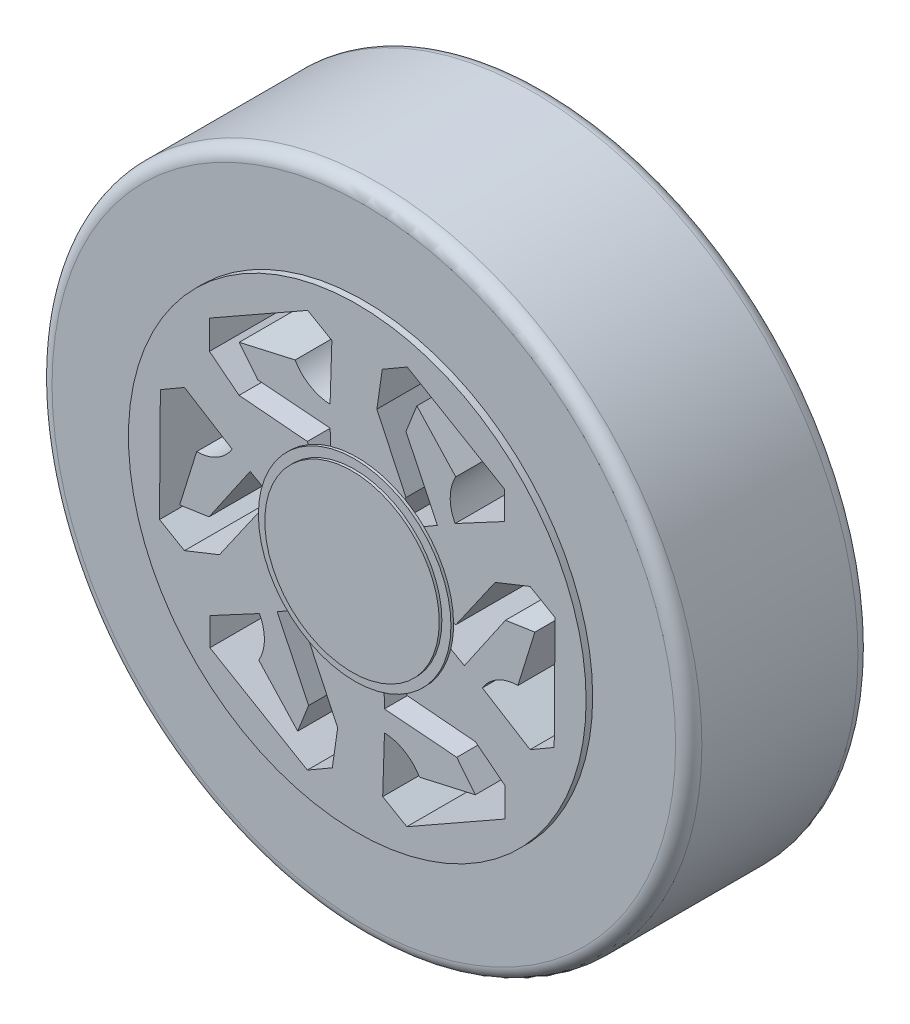
from build123d import *

# Parameters (mm, degrees)
SKETCH2_R           = 247.55
BOSS_EXTRUDE1_DEPTH = 138.9
FILLET1_R           = 10
FILLET2_R           = 10
SKETCH3_R           = 174.35
BOSS_EXTRUDE2_DEPTH = 5
CUT_EXTRUDE1_DEPTH  = 178
SKETCH9_R           = 73.351235991
BOSS_EXTRUDE3_DEPTH = 2
SKETCH10_R          = 66.449367693
BOSS_EXTRUDE4_DEPTH = 2


with BuildPart() as part:
    # Sketch2 → Boss-Extrude1 (new body)
    with BuildSketch(Plane.XY):
        Circle(SKETCH2_R)
    extrude(amount=BOSS_EXTRUDE1_DEPTH)

    # Fillet1
    fillet1_edges = [part.edges().sort_by_distance(p)[0] for p in [
        (-247.55, 0, 138.9),
    ]]
    fillet(fillet1_edges, radius=FILLET1_R)

    # Fillet2
    fillet2_edges = [part.edges().sort_by_distance(p)[0] for p in [
        (-247.55, 0, 0),
    ]]
    fillet(fillet2_edges, radius=FILLET2_R)

    # Sketch3 → Boss-Extrude2 (add)
    with BuildSketch(Plane.XY.offset(138.9)):
        Circle(SKETCH3_R)
    extrude(amount=BOSS_EXTRUDE2_DEPTH)

    # Sketch5 → Cut-Extrude1 (cut)
    with BuildSketch(Plane.XY.offset(143.9)):
        with BuildLine():
            Line((105.003706731, 43.369407929), (131.633696581, 54.021395774))
            Line((131.633696581, 54.021395774), (150.665269372, 43.031925067))
            Line((150.665269372, 43.031925067), (150.344554361, -0.360940867))
            Line((150.344554361, -0.360940867), (150.02910614, -43.041207894))
            Line((150.02910614, -43.041207894), (131.640430833, -53.657914533))
            Line((131.640430833, -53.657914533), (95.29019948, -31.084252667))
            ThreePointArc((95.29019948, -31.084252667), (106.873400183, -20.029907867), (122.363240346, -15.976029572))
            Line((122.363240346, -15.976029572), (135.299603851, 25.697677813))
            Line((135.299603851, 25.697677813), (112.925565246, 22.34468352))
            Line((112.925565246, 22.34468352), (81.592210025, -23.310129617))
            Line((81.592210025, -23.310129617), (40.25767623, 0.148769441))
            Line((40.25767623, 0.148769441), (75.177682959, 0.55093352))
            Line((75.177682959, 0.55093352), (105.003706731, 43.369407929))
        make_face()
        with BuildLine():
            Line((90.060862379, -69.251173556), (112.600749379, -86.987427346))
            Line((112.600749379, -86.987427346), (112.599374968, -108.963988211))
            Line((112.599374968, -108.963988211), (74.859693221, -130.38267383))
            Line((74.859693221, -130.38267383), (37.739773625, -151.449621172))
            Line((37.739773625, -151.449621172), (19.351098317, -140.832914533))
            Line((19.351098317, -140.832914533), (20.725347273, -98.065859815))
            ThreePointArc((20.725347273, -98.065859815), (36.090291044, -102.570033481), (47.345972712, -113.957689415))
            Line((47.345972712, -113.957689415), (89.90464373, -104.32405515))
            Line((89.90464373, -104.32405515), (75.813846191, -86.62406648))
            Line((75.813846191, -86.62406648), (20.608940598, -82.315991441))
            Line((20.608940598, -82.315991441), (20.25767623, -34.789785592))
            Line((20.25767623, -34.789785592), (38.065963903, -64.83031648))
            Line((38.065963903, -64.83031648), (90.060862379, -69.251173556))
        make_face()
        with BuildLine():
            Line((19.032947202, 141.008823121), (38.065894405, 151.995913278))
            Line((38.065894405, 151.995913278), (75.48486114, 130.021732964))
            Line((75.48486114, 130.021732964), (112.289332516, 108.408413278))
            Line((112.289332516, 108.408413278), (112.289332516, 87.175))
            Line((112.289332516, 87.175), (74.564852207, 66.981607148))
            ThreePointArc((74.564852207, 66.981607148), (70.78310914, 82.540125614), (75.017267633, 97.981659843))
            Line((75.017267633, 97.981659843), (45.394960121, 130.021732964))
            Line((45.394960121, 130.021732964), (37.111719056, 108.96875))
            Line((37.111719056, 108.96875), (60.983269426, 59.005861824))
            Line((60.983269426, 59.005861824), (20, 34.938555033))
            Line((20, 34.938555033), (37.111719056, 65.38125))
            Line((37.111719056, 65.38125), (14.942844352, 112.620581485))
            Line((14.942844352, 112.620581485), (19.032947202, 141.008823121))
        make_face()
        with BuildLine():
            Line((-14.942844352, -112.620581485), (-19.032947202, -141.008823121))
            Line((-19.032947202, -141.008823121), (-38.065894405, -151.995913278))
            Line((-38.065894405, -151.995913278), (-75.48486114, -130.021732964))
            Line((-75.48486114, -130.021732964), (-112.289332516, -108.408413278))
            Line((-112.289332516, -108.408413278), (-112.289332516, -87.175))
            Line((-112.289332516, -87.175), (-74.564852207, -66.981607148))
            ThreePointArc((-74.564852207, -66.981607148), (-70.78310914, -82.540125614), (-75.017267633, -97.981659843))
            Line((-75.017267633, -97.981659843), (-45.394960121, -130.021732964))
            Line((-45.394960121, -130.021732964), (-37.111719056, -108.96875))
            Line((-37.111719056, -108.96875), (-60.983269426, -59.005861824))
            Line((-60.983269426, -59.005861824), (-20, -34.938555033))
            Line((-20, -34.938555033), (-37.111719056, -65.38125))
            Line((-37.111719056, -65.38125), (-14.942844352, -112.620581485))
        make_face()
        with BuildLine():
            Line((-105.003706731, -43.369407929), (-131.633696581, -54.021395774))
            Line((-131.633696581, -54.021395774), (-150.665269372, -43.031925067))
            Line((-150.665269372, -43.031925067), (-150.344554361, 0.360940867))
            Line((-150.344554361, 0.360940867), (-150.02910614, 43.041207894))
            Line((-150.02910614, 43.041207894), (-131.640430833, 53.657914533))
            Line((-131.640430833, 53.657914533), (-95.29019948, 31.084252667))
            ThreePointArc((-95.29019948, 31.084252667), (-106.873400183, 20.029907867), (-122.363240346, 15.976029572))
            Line((-122.363240346, 15.976029572), (-135.299603851, -25.697677813))
            Line((-135.299603851, -25.697677813), (-112.925565246, -22.34468352))
            Line((-112.925565246, -22.34468352), (-81.592210025, 23.310129617))
            Line((-81.592210025, 23.310129617), (-40.25767623, -0.148769441))
            Line((-40.25767623, -0.148769441), (-75.177682959, -0.55093352))
            Line((-75.177682959, -0.55093352), (-105.003706731, -43.369407929))
        make_face()
        with BuildLine():
            Line((-90.060862379, 69.251173556), (-112.600749379, 86.987427346))
            Line((-112.600749379, 86.987427346), (-112.599374968, 108.963988211))
            Line((-112.599374968, 108.963988211), (-74.859693221, 130.38267383))
            Line((-74.859693221, 130.38267383), (-37.739773625, 151.449621172))
            Line((-37.739773625, 151.449621172), (-19.351098317, 140.832914533))
            Line((-19.351098317, 140.832914533), (-20.725347273, 98.065859815))
            ThreePointArc((-20.725347273, 98.065859815), (-36.090291044, 102.570033481), (-47.345972712, 113.957689415))
            Line((-47.345972712, 113.957689415), (-89.90464373, 104.32405515))
            Line((-89.90464373, 104.32405515), (-75.813846191, 86.62406648))
            Line((-75.813846191, 86.62406648), (-20.608940598, 82.315991441))
            Line((-20.608940598, 82.315991441), (-20.25767623, 34.789785592))
            Line((-20.25767623, 34.789785592), (-38.065963903, 64.83031648))
            Line((-38.065963903, 64.83031648), (-90.060862379, 69.251173556))
        make_face()
    extrude(amount=-CUT_EXTRUDE1_DEPTH, mode=Mode.SUBTRACT)

    # Sketch9 → Boss-Extrude3 (add)
    with BuildSketch(Plane.XY.offset(143.9)):
        with Locations(Location((0, 0, 0), (0, 0, 180.413898519))):
            Circle(SKETCH9_R)
    extrude(amount=BOSS_EXTRUDE3_DEPTH)

    # Sketch10 → Boss-Extrude4 (add)
    with BuildSketch(Plane.XY.offset(145.9)):
        Circle(SKETCH10_R)
    extrude(amount=BOSS_EXTRUDE4_DEPTH)


solid = part.part
